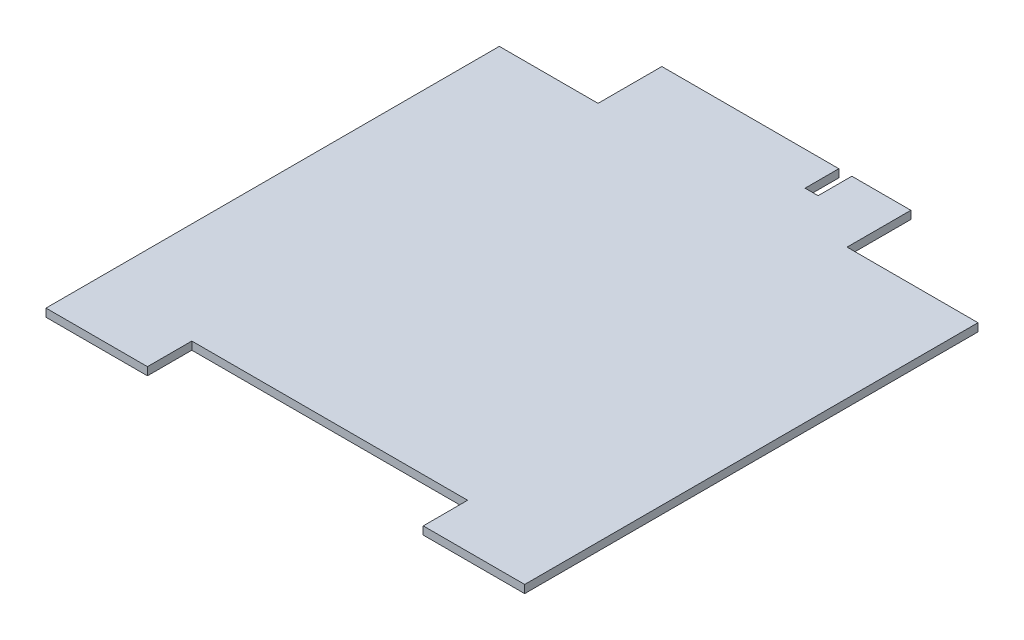
from build123d import *

# Parameters (mm, degrees)
SKETCH1_W           = 49.880837057
SKETCH1_H           = 12.780388143
SKETCH1_W_2         = 95.885
SKETCH1_H_2         = 90.805
BOSS_EXTRUDE1_DEPTH = 1.6
SKETCH2_W           = 55.245
SKETCH2_H           = 8.89
SKETCH2_W_2         = 2.610734202
SKETCH2_H_2         = 6.76
CUT_EXTRUDE1_DEPTH  = 1.6


with BuildPart() as part:
    # Sketch1 → Boss-Extrude1 (new body)
    with BuildSketch(Plane(origin=(0, 0, 0), x_dir=(1, 0, 0), z_dir=(0, 1, 0))):
        with Locations((-3.227112148, 51.792694072)):
            Rectangle(SKETCH1_W, SKETCH1_H)
        Rectangle(SKETCH1_W_2, SKETCH1_H_2)
    extrude(amount=BOSS_EXTRUDE1_DEPTH)

    # Sketch2 → Cut-Extrude1 (cut)
    with BuildSketch(Plane(origin=(0, 1.6, 0), x_dir=(1, 0, 0), z_dir=(0, 1, 0))):
        with Locations((0, -40.9575)):
            Rectangle(SKETCH2_W, SKETCH2_H)
        with Locations((8.587941455, 54.802888143)):
            Rectangle(SKETCH2_W_2, SKETCH2_H_2)
    extrude(amount=-CUT_EXTRUDE1_DEPTH, mode=Mode.SUBTRACT)


solid = part.part
